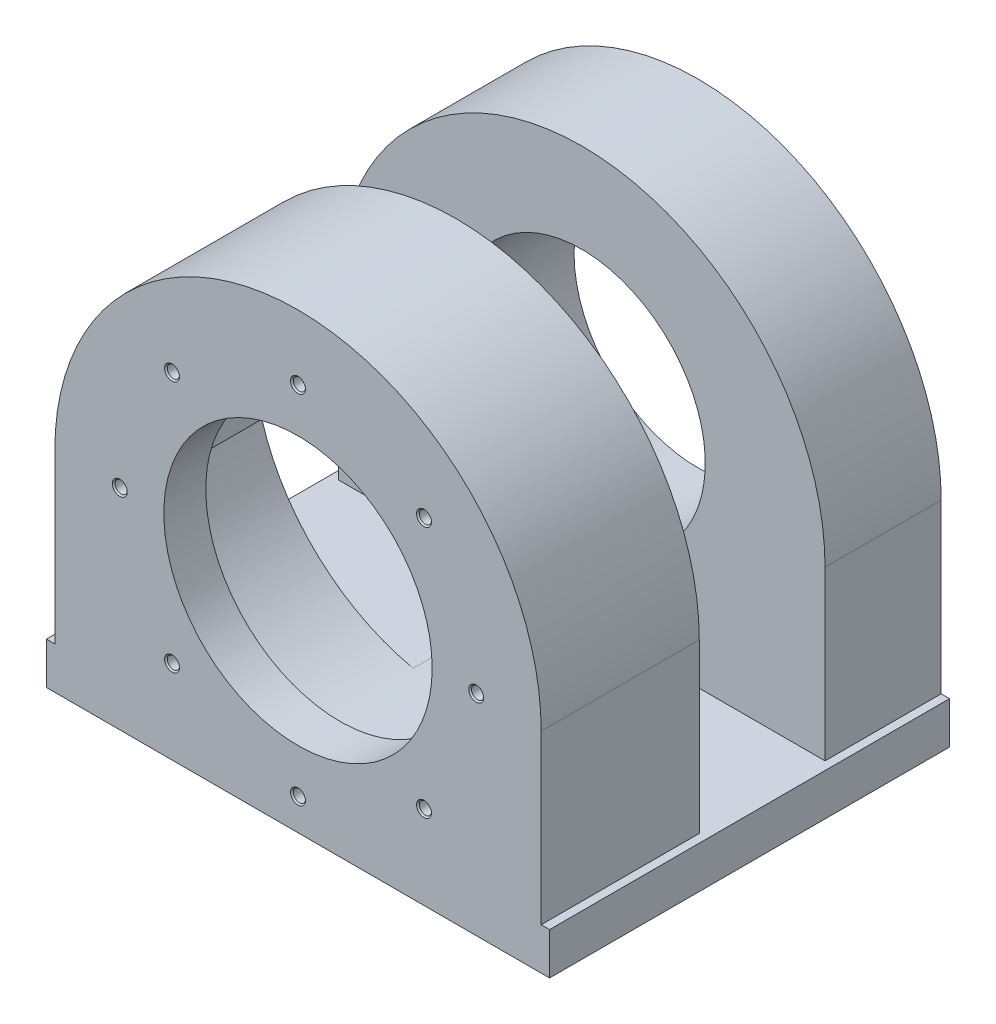
from build123d import *

# Parameters (mm, degrees)
EXTRUDE_9_DEPTH          = 27.7
EXTRUDE_START            = 15
EXTRUDE_10_DEPTH         = 15
SKETCH_9_W               = 120
SKETCH_9_H               = 10
EXTRUDE_11_DEPTH         = 27.7
SKETCH_10_R              = 29.5
EXTRUDE_14_DEPTH         = 27.7
EXTRUDE_15_DEPTH         = 10
SKETCH_12_R              = 32
CUT_EXTRUDE_1_DEPTH      = 10
PATTERN_CIRCULAR_1_COUNT = 8
PATTERN_CIRCULAR_2_COUNT = 6


with BuildPart() as part:
    # 草图1 → 凸台-拉伸9 (new body)
    with BuildSketch(Plane.XY):
        with BuildLine():
            Line((-45.634664851, -2.764128119), (74.365335149, -2.764128119))
            Line((74.365335149, -2.764128119), (74.365335149, 7.235871881))
            Line((74.365335149, 7.235871881), (72.365335149, 7.235871881))
            Line((72.365335149, 7.235871881), (72.365335149, 47.235871881))
            ThreePointArc((72.365335149, 47.235871881), (14.365335149, 105.235871881), (-43.634664851, 47.235871881))
            Line((-43.634664851, 47.235871881), (-43.634664851, 7.235871881))
            Line((-43.634664851, 7.235871881), (-45.634664851, 7.235871881))
            Line((-45.634664851, 7.235871881), (-45.634664851, -2.764128119))
        make_face()
        with BuildLine():
            Line((-31.9477266, 40.650970024), (-31.9477266, 68.146424194))
            ThreePointArc((-31.9477266, 68.146424194), (14.3022734, 102.648697109), (60.5522734, 68.146424194))
            Line((60.5522734, 68.146424194), (60.5522734, 40.650970024))
            ThreePointArc((60.5522734, 40.650970024), (14.3022734, 6.148697109), (-31.9477266, 40.650970024))
        make_face(mode=Mode.SUBTRACT)
    extrude(amount=EXTRUDE_9_DEPTH)

    # 草图8 → 凸台-拉伸10 (add)
    with BuildSketch(Plane(origin=(0, 0, 0), x_dir=(-1, 0, 0), z_dir=(0, 0, -1)).offset(EXTRUDE_START)):
        with BuildLine():
            Line((-74.365335149, -2.764128119), (45.634664851, -2.764128119))
            Line((45.634664851, -2.764128119), (45.634664851, 7.235871881))
            Line((45.634664851, 7.235871881), (-4.117460368, 7.235871881))
            ThreePointArc((-4.117460368, 7.235871881), (-14.3022734, 6.148697109), (-24.487086433, 7.235871881))
            Line((-24.487086433, 7.235871881), (-74.365335149, 7.235871881))
            Line((-74.365335149, 7.235871881), (-74.365335149, -2.764128119))
        make_face()
    extrude_10 = extrude(amount=-EXTRUDE_10_DEPTH)

    # 镜向4: 凸台-拉伸10 across plane
    add(extrude_10.mirror(Plane(origin=(0, 0, -15), x_dir=(1, 0, 0), z_dir=(0, 0, -1))))

    # 草图9 → 凸台-拉伸11 (add)
    with BuildSketch(Plane(origin=(0, 0, -30), x_dir=(-1, 0, 0), z_dir=(0, 0, -1))):
        with Locations((-14.365335149, 2.235871881)):
            Rectangle(SKETCH_9_W, SKETCH_9_H)
    extrude(amount=EXTRUDE_11_DEPTH)

    # 草图10 → 凸台-拉伸14 (add)
    with BuildSketch(Plane(origin=(0, 0, -57.7), x_dir=(-1, 0, 0), z_dir=(0, 0, -1))):
        with BuildLine():
            Line((-72.365335149, 47.235871881), (-72.365335149, 7.235871881))
            Line((-72.365335149, 7.235871881), (43.634664851, 7.235871881))
            Line((43.634664851, 7.235871881), (43.634664851, 47.235871881))
            ThreePointArc((43.634664851, 47.235871881), (-14.365335149, 105.235871881), (-72.365335149, 47.235871881))
        make_face()
        with Locations((-14.3022734, 54.398697109)):
            Circle(SKETCH_10_R, mode=Mode.SUBTRACT)
    extrude(amount=-EXTRUDE_14_DEPTH)

    # 草图11 → 凸台-拉伸15 (add)
    with BuildSketch(Plane.XY.offset(27.7)):
        with BuildLine():
            Line((-45.634664851, 7.235871881), (-45.634664851, -2.764128119))
            Line((-45.634664851, -2.764128119), (74.365335149, -2.764128119))
            Line((74.365335149, -2.764128119), (74.365335149, 7.235871881))
            Line((74.365335149, 7.235871881), (72.365335149, 7.235871881))
            Line((72.365335149, 7.235871881), (72.365335149, 47.235871881))
            ThreePointArc((72.365335149, 47.235871881), (14.365335149, 105.235871881), (-43.634664851, 47.235871881))
            Line((-43.634664851, 47.235871881), (-43.634664851, 7.235871881))
            Line((-43.634664851, 7.235871881), (-45.634664851, 7.235871881))
        make_face()
    extrude(amount=EXTRUDE_15_DEPTH)

    # 草图12 → 切除-拉伸1 (cut)
    with BuildSketch(Plane.XY.offset(37.7)):
        with Locations((14.365335149, 47.235871881)):
            Circle(SKETCH_12_R)
    extrude(amount=-CUT_EXTRUDE_1_DEPTH, mode=Mode.SUBTRACT)

    # 草图22 → M3.5 螺纹孔5 (revolve, cut)
    with BuildSketch(Plane(origin=(14.365335149, 89.735871881, 37.7), x_dir=(0, -1, 0), z_dir=(1, 0, 0))):
        Polygon((0, 0), (0, 10.871247898), (1.45, 10), (1.45, 0.325), (1.775, 0), align=None)
    hole_wizard_m3_5_5 = revolve(axis=Axis((14.365335149, 89.735871881, 44.05), (0, 0, -1)), mode=Mode.SUBTRACT)

    # 阵列(圆周)1: M3.5 螺纹孔5 ×8 about axis
    pattern_circular_1_axis = Axis((14.365335149, 47.235871881, 0), (0, 0, 1))
    for i in range(1, PATTERN_CIRCULAR_1_COUNT):
        add(hole_wizard_m3_5_5.rotate(pattern_circular_1_axis, i * 360 / PATTERN_CIRCULAR_1_COUNT), mode=Mode.SUBTRACT)

    # 草图25 → M4 螺纹孔1 (revolve, cut)
    with BuildSketch(Plane(origin=(-2.738231277, -2.764128119, -10), x_dir=(0, 0, -1), z_dir=(1, 0, 0))):
        Polygon((0, 0), (0, 2.491420021), (1.65, 1.5), (1.65, 0.375), (2.025, 0), align=None)
    hole_wizard_m4_1 = revolve(axis=Axis((-2.738231277, -9.114128119, -10), (0, 1, 0)), mode=Mode.SUBTRACT)

    # 阵列(圆周)2: M4 螺纹孔1 ×6 about axis
    pattern_circular_2_axis = Axis((14.384603563, 0, -10), (0, 1, 0))
    for i in range(1, PATTERN_CIRCULAR_2_COUNT):
        add(hole_wizard_m4_1.rotate(pattern_circular_2_axis, i * 360 / PATTERN_CIRCULAR_2_COUNT), mode=Mode.SUBTRACT)


solid = part.part
